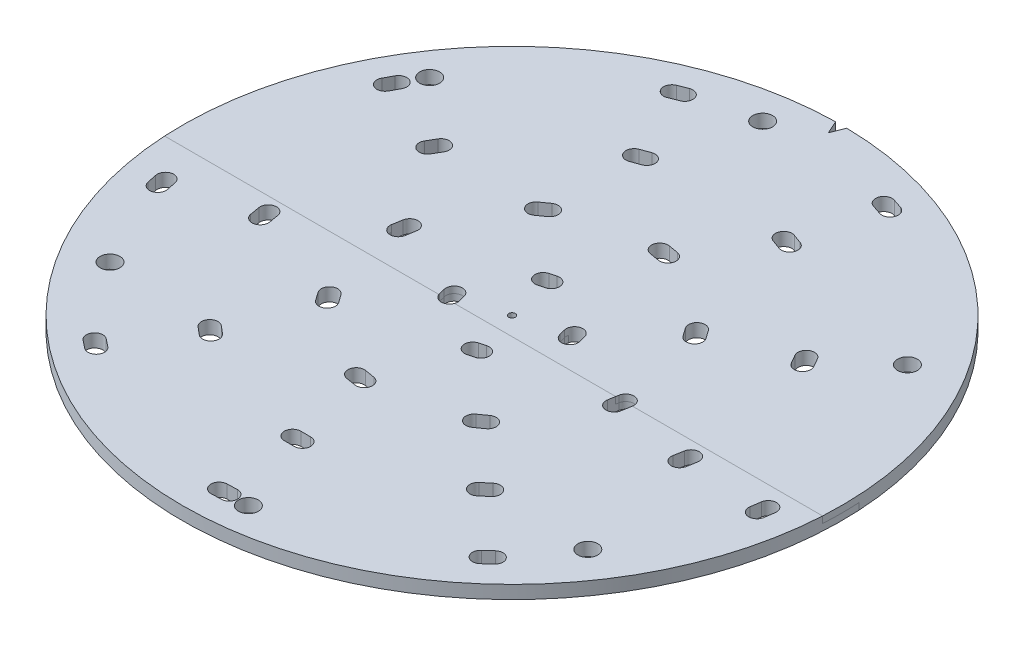
from build123d import *

# Parameters (mm, degrees)
CROQUIS1_R              = 100
SALIENTE_EXTRUIR1_DEPTH = 4
CROQUIS2_R              = 1
CORTAR_EXTRUIR1_DEPTH   = 142.477913471
CROQUIS3_R              = 3
CORTAR_EXTRUIR2_DEPTH   = 142.477913471
CORTAR_EXTRUIR3_DEPTH   = 142.477913471
PARTIR1_SURFACE_1_BACK  = 283.862
PARTIR1_SURFACE_1_DEPTH = 567.724
PARTIR1_SURFACE_2_BACK  = 283.862
PARTIR1_SURFACE_2_DEPTH = 567.724


with BuildPart() as part:
    # Croquis1 → Saliente-Extruir1 (new body)
    with BuildSketch(Plane(origin=(0, 0, 0), x_dir=(1, 0, 0), z_dir=(0, 1, 0))):
        with Locations(Location((0, 0, 0), (0, 0, 270))):
            Circle(CROQUIS1_R)
    extrude(amount=SALIENTE_EXTRUIR1_DEPTH)

    # Croquis2 → Cortar-Extruir1 (cut, through all)
    with BuildSketch(Plane(origin=(0, 4, 0), x_dir=(1, 0, 0), z_dir=(0, 1, 0))):
        with Locations(Location((0, 0, 0), (0, 0, 270))):
            Circle(CROQUIS2_R)
        Polygon((-1.773240603, 99.984276853), (0, 95.98839466), (1.610424085, 99.98703183), (0, 102.310642999), align=None)
    extrude(amount=-CORTAR_EXTRUIR1_DEPTH, mode=Mode.SUBTRACT)

    # Croquis3 → Cortar-Extruir2 (cut, through all)
    with BuildSketch(Plane(origin=(0, 4, 0), x_dir=(1, 0, 0), z_dir=(0, 1, 0))):
        with Locations(Location((-13, 89.056162055, 0), (0, 0, 270))):
            Circle(CROQUIS3_R)
        with Locations(Location((73, 47, 0), (0, 0, 270))):
            Circle(CROQUIS3_R)
        with Locations(Location((73, -50, 0), (0, 0, 270))):
            Circle(CROQUIS3_R)
        with Locations(Location((10, -90, 0), (0, 0, 270))):
            Circle(CROQUIS3_R)
        with Locations(Location((-75, 50, 0), (0, 0, 270))):
            Circle(CROQUIS3_R)
        with Locations(Location((-75, -47, 0), (0, 0, 270))):
            Circle(CROQUIS3_R)
    extrude(amount=-CORTAR_EXTRUIR2_DEPTH, mode=Mode.SUBTRACT)

    # Croquis4 → Cortar-Extruir3 (cut, through all)
    with BuildSketch(Plane(origin=(0, 4, 0), x_dir=(1, 0, 0), z_dir=(0, 1, 0))):
        with BuildLine():
            Line((-82.114258616, 42.584457582), (-80.690130858, 45.224885602))
            ThreePointArc((-80.690130858, 45.224885602), (-77.303001043, 46.238469154), (-76.289417492, 42.851339339))
            Line((-76.289417492, 42.851339339), (-77.713545249, 40.210911319))
            ThreePointArc((-77.713545249, 40.210911319), (-81.100675064, 39.197327767), (-82.114258616, 42.584457582))
        make_face()
        with BuildLine():
            Line((-35.521038068, 85.421711304), (-32.732858497, 86.528984839))
            ThreePointArc((-32.732858497, 86.528984839), (-29.486647576, 85.128229809), (-30.887402606, 81.882018887))
            Line((-30.887402606, 81.882018887), (-33.675582177, 80.774745353))
            ThreePointArc((-33.675582177, 80.774745353), (-36.921793098, 82.175500383), (-35.521038068, 85.421711304))
        make_face()
        with BuildLine():
            Line((27.706695545, 88.287406612), (30.55430672, 87.343420069))
            ThreePointArc((30.55430672, 87.343420069), (32.14066058, 84.183755303), (28.980995815, 82.597401443))
            Line((28.980995815, 82.597401443), (26.133384639, 83.541387987))
            ThreePointArc((26.133384639, 83.541387987), (24.547030779, 86.701052752), (27.706695545, 88.287406612))
        make_face()
        with BuildLine():
            Line((91.785522645, -11.928886676), (91.35035987, -14.897157782))
            ThreePointArc((91.35035987, -14.897157782), (88.514164969, -17.008081391), (86.40324136, -14.171886489))
            Line((86.40324136, -14.171886489), (86.838404135, -11.203615383))
            ThreePointArc((86.838404135, -11.203615383), (89.674599036, -9.092691774), (91.785522645, -11.928886676))
        make_face()
        with BuildLine():
            Line((62.653420775, -68.118557862), (60.41209886, -70.112668209))
            ThreePointArc((60.41209886, -70.112668209), (56.882571976, -69.906658568), (57.088581616, -66.377131684))
            Line((57.088581616, -66.377131684), (59.329903531, -64.383021337))
            ThreePointArc((59.329903531, -64.383021337), (62.859430416, -64.589030978), (62.653420775, -68.118557862))
        make_face()
        with BuildLine():
            Line((4.21891159, -92.43658911), (1.220169969, -92.523472303))
            ThreePointArc((1.220169969, -92.523472303), (-1.351184043, -90.096923613), (1.075364646, -87.525569601))
            Line((1.075364646, -87.525569601), (4.074106268, -87.438686408))
            ThreePointArc((4.074106268, -87.438686408), (6.64546028, -89.865235098), (4.21891159, -92.43658911))
        make_face()
        with BuildLine():
            Line((-56.175848635, -73.504303332), (-58.528865431, -71.643305761))
            ThreePointArc((-58.528865431, -71.643305761), (-58.938881451, -68.131627122), (-55.427202812, -67.721611102))
            Line((-55.427202812, -67.721611102), (-53.074186017, -69.582608673))
            ThreePointArc((-53.074186017, -69.582608673), (-52.664169997, -73.094287312), (-56.175848635, -73.504303332))
        make_face()
        with BuildLine():
            Line((-90.271480379, -20.180327453), (-90.877769639, -17.242230564))
            ThreePointArc((-90.877769639, -17.242230564), (-88.934596614, -14.288575439), (-85.98094149, -16.231748463))
            Line((-85.98094149, -16.231748463), (-85.374652229, -19.169845353))
            ThreePointArc((-85.374652229, -19.169845353), (-87.317825254, -22.123500478), (-90.271480379, -20.180327453))
        make_face()
        with BuildLine():
            Line((-53.303023428, 32.636241257), (-54.807690718, 30.040865302))
            ThreePointArc((-54.807690718, 30.040865302), (-58.224393422, 29.131941415), (-59.13331731, 32.548644119))
            Line((-59.13331731, 32.548644119), (-57.62865002, 35.144020073))
            ThreePointArc((-57.62865002, 35.144020073), (-54.211947316, 36.052943961), (-53.303023428, 32.636241257))
        make_face()
        with BuildLine():
            Line((-19.854313392, 59.263334278), (-22.675230915, 58.24234244))
            ThreePointArc((-22.675230915, 58.24234244), (-25.876822048, 59.742280511), (-24.376883977, 62.943871645))
            Line((-24.376883977, 62.943871645), (-21.555966454, 63.964863482))
            ThreePointArc((-21.555966454, 63.964863482), (-18.354375321, 62.464925411), (-19.854313392, 59.263334278))
        make_face()
        with BuildLine():
            Line((22.884450536, 58.160454551), (20.067221441, 59.191580259))
            ThreePointArc((20.067221441, 59.191580259), (18.578801952, 62.398542595), (21.785764288, 63.886962085))
            Line((21.785764288, 63.886962085), (24.602993383, 62.855836377))
            ThreePointArc((24.602993383, 62.855836377), (26.091412872, 59.648874041), (22.884450536, 58.160454551))
        make_face()
        with BuildLine():
            Line((54.915325727, 29.843651759), (53.419997862, 32.444419834))
            ThreePointArc((53.419997862, 32.444419834), (54.341198038, 35.857833116), (57.75461132, 34.936632941))
            Line((57.75461132, 34.936632941), (59.249939185, 32.335864866))
            ThreePointArc((59.249939185, 32.335864866), (58.328739009, 28.922451584), (54.915325727, 29.843651759))
        make_face()
        with BuildLine():
            Line((61.250709694, -12.437327366), (61.776963587, -9.483845211))
            ThreePointArc((61.776963587, -9.483845211), (64.676743627, -7.461154993), (66.699433845, -10.360935033))
            Line((66.699433845, -10.360935033), (66.173179952, -13.314417188))
            ThreePointArc((66.173179952, -13.314417188), (63.273399912, -15.337107407), (61.250709694, -12.437327366))
        make_face()
        with BuildLine():
            Line((38.926205869, -48.898742792), (41.227801474, -46.974513681))
            ThreePointArc((41.227801474, -46.974513681), (44.749322071, -47.28898576), (44.434849992, -50.810506356))
            Line((44.434849992, -50.810506356), (42.133254387, -52.734735467))
            ThreePointArc((42.133254387, -52.734735467), (38.61173379, -52.420263388), (38.926205869, -48.898742792))
        make_face()
        with BuildLine():
            Line((-1.612302298, -62.479893016), (1.387692856, -62.485285136))
            ThreePointArc((1.387692856, -62.485285136), (3.883195384, -64.989774531), (1.378705989, -67.48527706))
            Line((1.378705989, -67.48527706), (-1.621289165, -67.47988494))
            ThreePointArc((-1.621289165, -67.47988494), (-4.116791693, -64.975395544), (-1.612302298, -62.479893016))
        make_face()
        with BuildLine():
            Line((-41.396396301, -46.826006911), (-39.101732672, -48.758497229))
            ThreePointArc((-39.101732672, -48.758497229), (-38.799921579, -52.281125518), (-42.322549868, -52.582936611))
            Line((-42.322549868, -52.582936611), (-44.617213498, -50.650446293))
            ThreePointArc((-44.617213498, -50.650446293), (-44.919024591, -47.127818004), (-41.396396301, -46.826006911))
        make_face()
        with BuildLine():
            Line((-61.810656405, -9.26171176), (-61.295022915, -12.217066578))
            ThreePointArc((-61.295022915, -12.217066578), (-63.328124023, -15.109556835), (-66.22061428, -13.076455728))
            Line((-66.22061428, -13.076455728), (-66.73624777, -10.12110091))
            ThreePointArc((-66.73624777, -10.12110091), (-64.703146663, -7.228610652), (-61.810656405, -9.26171176))
        make_face()
        with BuildLine():
            Line((-36.69921819, 7.71738678), (-37.198658467, 4.759252332))
            ThreePointArc((-37.198658467, 4.759252332), (-40.079970737, 2.710340523), (-42.128882546, 5.591652793))
            Line((-42.128882546, 5.591652793), (-41.629442269, 8.549787241))
            ThreePointArc((-41.629442269, 8.549787241), (-38.748129999, 10.59869905), (-36.69921819, 7.71738678))
        make_face()
        with BuildLine():
            Line((-20.493249521, 31.407282572), (-22.938124055, 29.66872325))
            ThreePointArc((-22.938124055, 29.66872325), (-26.424318934, 30.257319261), (-25.835722924, 33.74351414))
            Line((-25.835722924, 33.74351414), (-23.39084839, 35.482073461))
            ThreePointArc((-23.39084839, 35.482073461), (-19.904653511, 34.893477451), (-20.493249521, 31.407282572))
        make_face()
        with BuildLine():
            Line((7.71738678, 36.69921819), (4.759252332, 37.198658467))
            ThreePointArc((4.759252332, 37.198658467), (2.710340523, 40.079970737), (5.591652793, 42.128882546))
            Line((5.591652793, 42.128882546), (8.549787241, 41.629442269))
            ThreePointArc((8.549787241, 41.629442269), (10.59869905, 38.748129999), (7.71738678, 36.69921819))
        make_face()
        with BuildLine():
            Line((31.407282572, 20.493249521), (29.66872325, 22.938124055))
            ThreePointArc((29.66872325, 22.938124055), (30.257319261, 26.424318934), (33.74351414, 25.835722924))
            Line((33.74351414, 25.835722924), (35.482073461, 23.39084839))
            ThreePointArc((35.482073461, 23.39084839), (34.893477451, 19.904653511), (31.407282572, 20.493249521))
        make_face()
        with BuildLine():
            Line((36.69921819, -7.71738678), (37.198658467, -4.759252332))
            ThreePointArc((37.198658467, -4.759252332), (40.079970737, -2.710340523), (42.128882546, -5.591652793))
            Line((42.128882546, -5.591652793), (41.629442269, -8.549787241))
            ThreePointArc((41.629442269, -8.549787241), (38.748129999, -10.59869905), (36.69921819, -7.71738678))
        make_face()
        with BuildLine():
            Line((20.493249521, -31.407282572), (22.938124055, -29.66872325))
            ThreePointArc((22.938124055, -29.66872325), (26.424318934, -30.257319261), (25.835722924, -33.74351414))
            Line((25.835722924, -33.74351414), (23.39084839, -35.482073461))
            ThreePointArc((23.39084839, -35.482073461), (19.904653511, -34.893477451), (20.493249521, -31.407282572))
        make_face()
        with BuildLine():
            Line((-7.71738678, -36.69921819), (-4.759252332, -37.198658467))
            ThreePointArc((-4.759252332, -37.198658467), (-2.710340523, -40.079970737), (-5.591652793, -42.128882546))
            Line((-5.591652793, -42.128882546), (-8.549787241, -41.629442269))
            ThreePointArc((-8.549787241, -41.629442269), (-10.59869905, -38.748129999), (-7.71738678, -36.69921819))
        make_face()
        with BuildLine():
            Line((-31.407282572, -20.493249521), (-29.66872325, -22.938124055))
            ThreePointArc((-29.66872325, -22.938124055), (-30.257319261, -26.424318934), (-33.74351414, -25.835722924))
            Line((-33.74351414, -25.835722924), (-35.482073461, -23.39084839))
            ThreePointArc((-35.482073461, -23.39084839), (-34.893477451, -19.904653511), (-31.407282572, -20.493249521))
        make_face()
        with BuildLine():
            Line((-16.642728906, -5.394693902), (-17.149678678, -3.460009967))
            ThreePointArc((-17.149678678, -3.460009967), (-15.365010975, -0.407967833), (-12.312968841, -2.192635536))
            Line((-12.312968841, -2.192635536), (-11.806019068, -4.127319471))
            ThreePointArc((-11.806019068, -4.127319471), (-13.590686772, -7.179361605), (-16.642728906, -5.394693902))
        make_face()
        with BuildLine():
            Line((-5.394693902, 16.642728906), (-3.460009967, 17.149678678))
            ThreePointArc((-3.460009967, 17.149678678), (-0.407967833, 15.365010975), (-2.192635536, 12.312968841))
            Line((-2.192635536, 12.312968841), (-4.127319471, 11.806019068))
            ThreePointArc((-4.127319471, 11.806019068), (-7.179361605, 13.590686772), (-5.394693902, 16.642728906))
        make_face()
        with BuildLine():
            Line((16.642728906, 5.394693902), (17.149678678, 3.460009967))
            ThreePointArc((17.149678678, 3.460009967), (15.365010975, 0.407967833), (12.312968841, 2.192635536))
            Line((12.312968841, 2.192635536), (11.806019068, 4.127319471))
            ThreePointArc((11.806019068, 4.127319471), (13.590686772, 7.179361605), (16.642728906, 5.394693902))
        make_face()
        with BuildLine():
            Line((5.394693902, -16.642728906), (3.460009967, -17.149678678))
            ThreePointArc((3.460009967, -17.149678678), (0.407967833, -15.365010975), (2.192635536, -12.312968841))
            Line((2.192635536, -12.312968841), (4.127319471, -11.806019068))
            ThreePointArc((4.127319471, -11.806019068), (7.179361605, -13.590686772), (5.394693902, -16.642728906))
        make_face()
    extrude(amount=-CORTAR_EXTRUIR3_DEPTH, mode=Mode.SUBTRACT)


with BuildPart() as body_2:
    # Partir1: the piece behind the surface
    add(part.part)
    # Partir1 surface: a surface, the sketch's curves swept straight by 567.724 mm
    with BuildLine(Plane(origin=(0, 0, 0), x_dir=(0, 0, -1), z_dir=(1, 0, 0)).offset(-PARTIR1_SURFACE_1_BACK), mode=Mode.PRIVATE) as partir1_surface_1_path:
        Line((-5.591652793, 4), (-5.591652793, 2))
        Line((-5.591652793, 2), (5.394693902, 2))
        Line((5.394693902, 2), (5.394693902, 0))
    partir1_surface_1 = Shell.extrude(partir1_surface_1_path.wire(), (1 * PARTIR1_SURFACE_1_DEPTH, 0 * PARTIR1_SURFACE_1_DEPTH, 0 * PARTIR1_SURFACE_1_DEPTH))
    split(bisect_by=partir1_surface_1, keep=Keep.BOTTOM)


with BuildPart() as part_1:
    add(part.part)

    # Partir1: split by a surface, the side it looks to stays
    # Partir1 surface: a surface, the sketch's curves swept straight by 567.724 mm
    with BuildLine(Plane(origin=(0, 0, 0), x_dir=(0, 0, -1), z_dir=(1, 0, 0)).offset(-PARTIR1_SURFACE_2_BACK), mode=Mode.PRIVATE) as partir1_surface_2_path:
        Line((-5.591652793, 4), (-5.591652793, 2))
        Line((-5.591652793, 2), (5.394693902, 2))
        Line((5.394693902, 2), (5.394693902, 0))
    partir1_surface_2 = Shell.extrude(partir1_surface_2_path.wire(), (1 * PARTIR1_SURFACE_2_DEPTH, 0 * PARTIR1_SURFACE_2_DEPTH, 0 * PARTIR1_SURFACE_2_DEPTH))
    split(bisect_by=partir1_surface_2, keep=Keep.TOP)


solid = Compound([body_2.part, part_1.part])
